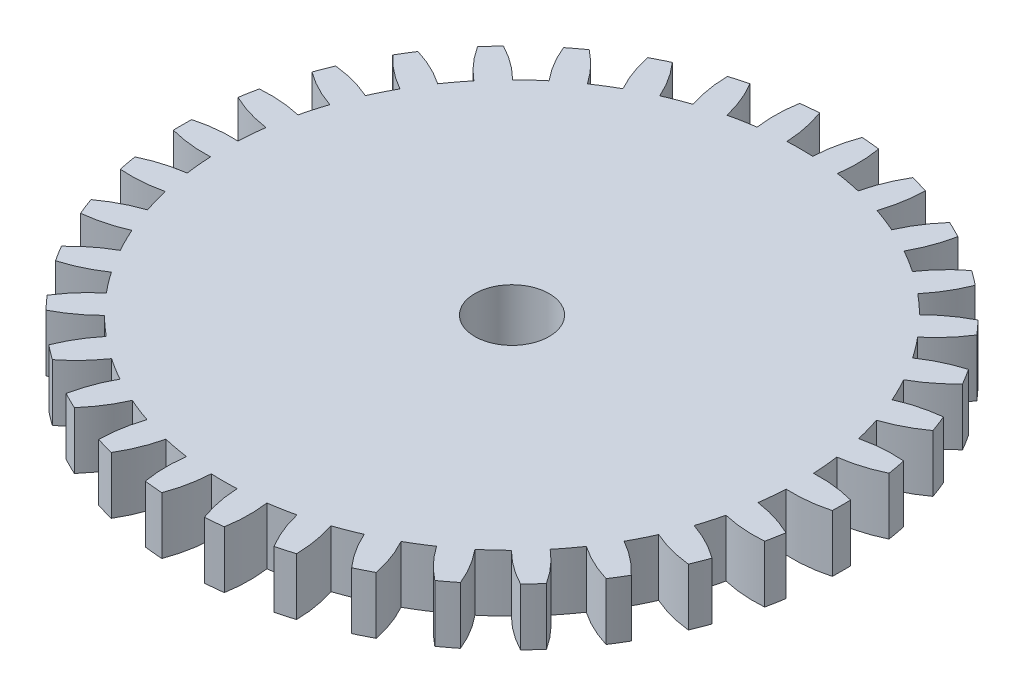
from build123d import *

# Parameters (mm, degrees)
SKETCH1_R           = 13.5001
BOSS_EXTRUDE1_DEPTH = 2.3368
CUT_EXTRUDE1_DEPTH  = 2.3368
SKETCH3_R           = 1.524
CUT_EXTRUDE2_DEPTH  = 2.3368
CIRPATTERN1_COUNT   = 34


with BuildPart() as part:
    # Sketch1 → Boss-Extrude1 (new body)
    with BuildSketch(Plane(origin=(0, 0, 0), x_dir=(1, 0, 0), z_dir=(0, 1, 0))):
        with Locations(Location((0, 0, 0), (0, 0, 270))):
            Circle(SKETCH1_R)
    extrude(amount=BOSS_EXTRUDE1_DEPTH)

    # Sketch2 → Cut-Extrude1 (cut)
    with BuildSketch(Plane(origin=(0, 2.3368, 0), x_dir=(1, 0, 0), z_dir=(0, 1, 0))):
        with BuildLine():
            Line((1.117288627, 14.032195245), (-1.117288627, 14.032195245))
            ThreePointArc((-1.117288627, 14.032195245), (-0.703588518, 12.942376626), (-0.528470774, 11.789907027))
            ThreePointArc((-0.528470774, 11.789907027), (0, 11.80174517), (0.528470774, 11.789907027))
            ThreePointArc((0.528470774, 11.789907027), (0.703588518, 12.942376626), (1.117288627, 14.032195245))
        make_face()
    cut_extrude1 = extrude(amount=-CUT_EXTRUDE1_DEPTH, mode=Mode.SUBTRACT)

    # Sketch3 → Cut-Extrude2 (cut)
    with BuildSketch(Plane(origin=(0, 0, 0), x_dir=(1, 0, 0), z_dir=(0, 1, 0))):
        with Locations(Location((0, 0, 0), (0, 0, 270))):
            Circle(SKETCH3_R)
    extrude(amount=CUT_EXTRUDE2_DEPTH, mode=Mode.SUBTRACT)

    # CirPattern1: Cut-Extrude1 ×34 about axis
    cirpattern1_axis = Axis((0, 0, 0), (0, 1, 0))
    for i in range(1, CIRPATTERN1_COUNT):
        add(cut_extrude1.rotate(cirpattern1_axis, i * 360 / CIRPATTERN1_COUNT), mode=Mode.SUBTRACT)


solid = part.part
